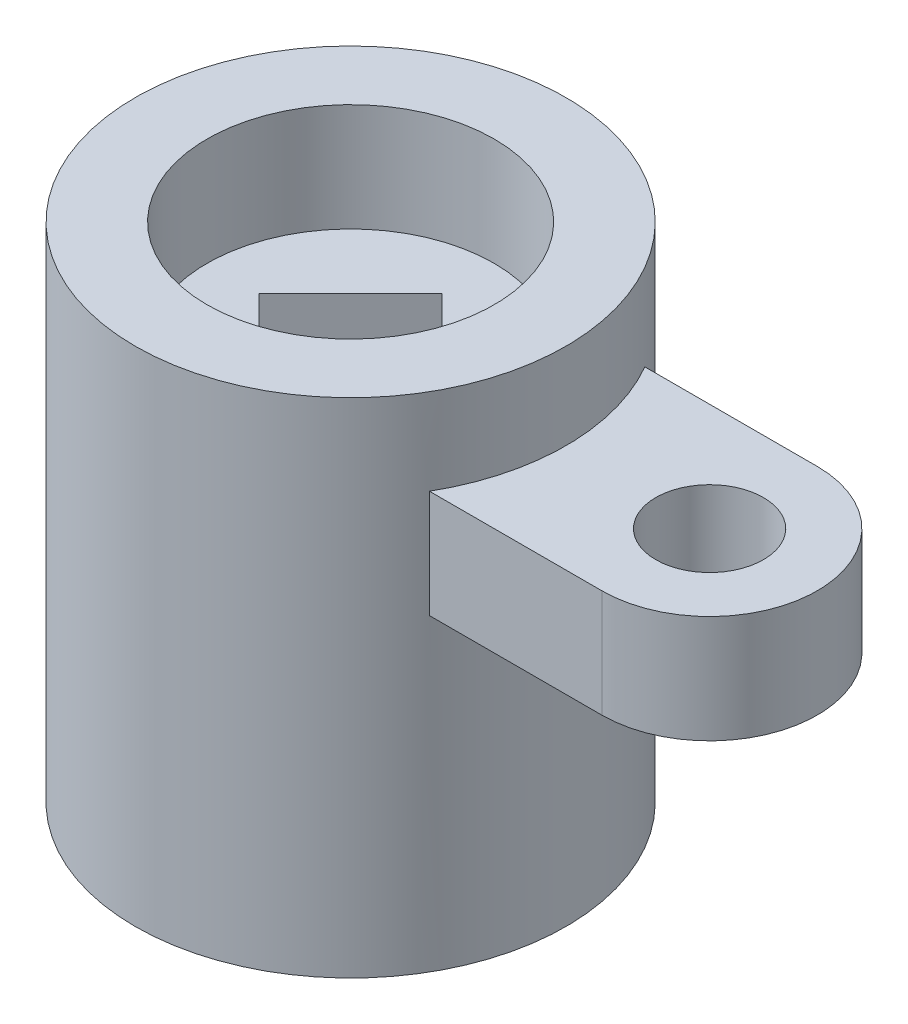
from build123d import *

# Parameters (mm, degrees)
SKETCH_1_R          = 30
EXTRUDE_1_DEPTH     = 70
EXTRUDE_START       = 43
SKETCH_1_4_R        = 7.5
EXTRUDE_2_DEPTH     = 15
SKETCH_3_R          = 20
CUT_EXTRUDE_1_DEPTH = 15
CUT_EXTRUDE_2_DEPTH = 91.277350426


with BuildPart() as part:
    # 草图1 → 凸台-拉伸1 (new body)
    with BuildSketch(Plane(origin=(0, 0, 0), x_dir=(1, 0, 0), z_dir=(0, 1, 0))):
        Circle(SKETCH_1_R)
    extrude(amount=EXTRUDE_1_DEPTH)

    # 草图1<4> → 凸台-拉伸2 (add)
    with BuildSketch(Plane(origin=(0, 0, 0), x_dir=(1, 0, 0), z_dir=(0, 1, 0)).offset(EXTRUDE_START)):
        with BuildLine():
            ThreePointArc((25.980762114, 15), (30, 0), (25.980762114, -15))
            Line((25.980762114, -15), (50, -15))
            ThreePointArc((50, -15), (65, 0), (50, 15))
            Line((50, 15), (25.980762114, 15))
        make_face()
        with Locations((50, 0)):
            Circle(SKETCH_1_4_R, mode=Mode.SUBTRACT)
    extrude(amount=EXTRUDE_2_DEPTH)

    # 草图3 → 切除-拉伸1 (cut)
    with BuildSketch(Plane(origin=(0, 70, 0), x_dir=(1, 0, 0), z_dir=(0, 1, 0))):
        Circle(SKETCH_3_R)
    extrude(amount=-CUT_EXTRUDE_1_DEPTH, mode=Mode.SUBTRACT)

    # 草图4 → 切除-拉伸2 (cut, through all)
    with BuildSketch(Plane(origin=(0, 55, 0), x_dir=(1, 0, 0), z_dir=(0, 1, 0))):
        Polygon((0, -12.727922061), (-12.727922061, 0), (0, 12.727922061), (12.727922061, 0), align=None)
    extrude(amount=-CUT_EXTRUDE_2_DEPTH, mode=Mode.SUBTRACT)


solid = part.part
